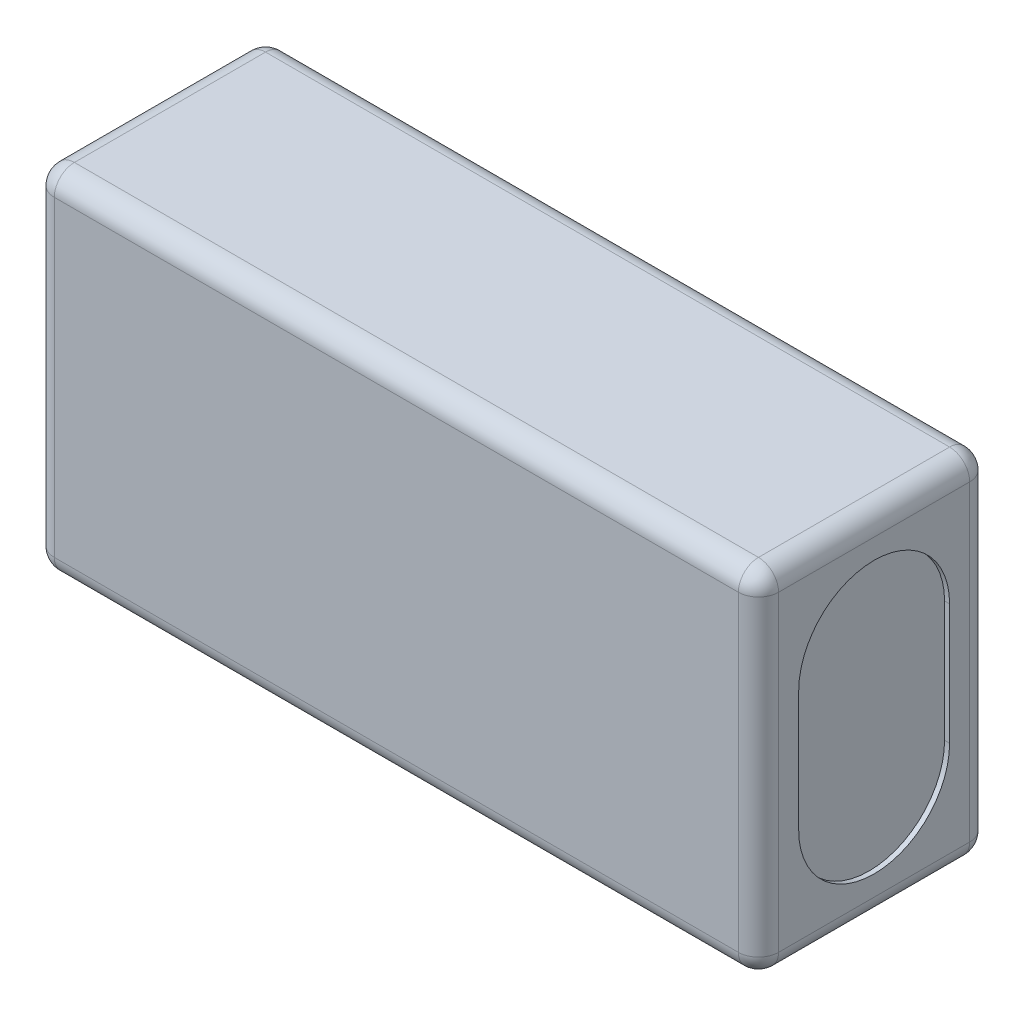
from build123d import *

# Parameters (mm, degrees)
ESBO_O1_W                = 72
ESBO_O1_H                = 35
RESSALTO_EXTRUS_O1_DEPTH = 23
CORTE_EXTRUS_O1_DEPTH    = 0.5
FILETE1_R                = 2


with BuildPart() as part:
    # Esboço1 → Ressalto-extrusão1 (new body)
    with BuildSketch(Plane.XY):
        Rectangle(ESBO_O1_W, ESBO_O1_H)
    extrude(amount=RESSALTO_EXTRUS_O1_DEPTH)

    # Esboço2 → Corte-extrusão1 (cut)
    with BuildSketch(Plane(origin=(36, 0, 0), x_dir=(0, 0, -1), z_dir=(1, 0, 0))):
        with BuildLine():
            Line((-4, 6), (-4, -6))
            ThreePointArc((-4, -6), (-11.5, -13.5), (-19, -6))
            Line((-19, -6), (-19, 6))
            ThreePointArc((-19, 6), (-11.5, 13.5), (-4, 6))
        make_face()
    corte_extrus_o1 = extrude(amount=-CORTE_EXTRUS_O1_DEPTH, mode=Mode.SUBTRACT)

    # Espelhar1: Corte-extrusão1 across plane
    add(corte_extrus_o1.mirror(Plane(origin=(0, 0, 0), x_dir=(0, 0, 1), z_dir=(1, 0, 0))), mode=Mode.SUBTRACT)

    # Filete1
    filete1_edges = [part.edges().sort_by_distance(p)[0] for p in [
        (-36, 0, 23),
        (0, -17.5, 23),
        (36, 0, 23),
        (0, -17.5, 0),
        (-36, 0, 0),
        (0, 17.5, 0),
        (36, 0, 0),
        (0, 17.5, 23),
        (36, -17.5, 11.5),
        (-36, -17.5, 11.5),
        (-36, 17.5, 11.5),
        (36, 17.5, 11.5),
    ]]
    fillet(filete1_edges, radius=FILETE1_R)


solid = part.part
